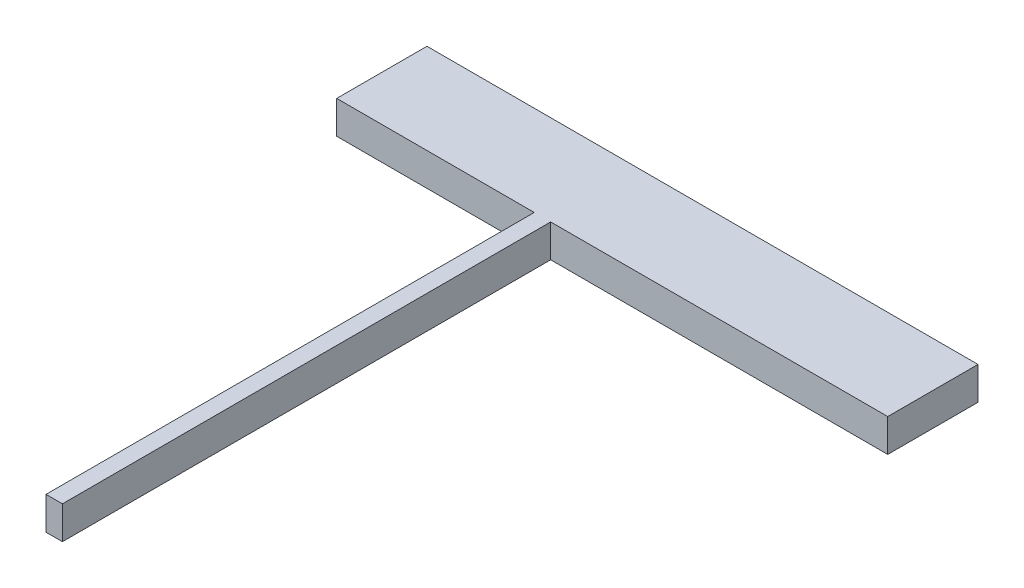
from build123d import *

# Parameters (mm, degrees)
SKETCH_1_W      = 134.3
SKETCH_1_H      = 22
EXTRUDE_1_DEPTH = 8
SKETCH_2_W      = 4
SKETCH_2_H      = 8
EXTRUDE_2_DEPTH = 130


with BuildPart() as part:
    # 草图1 → 凸台-拉伸1 (new body)
    with BuildSketch(Plane(origin=(0, 0, 0), x_dir=(1, 0, 0), z_dir=(0, 1, 0))):
        Rectangle(SKETCH_1_W, SKETCH_1_H)
    extrude(amount=EXTRUDE_1_DEPTH)

    # 草图2 → 凸台-拉伸2 (add)
    with BuildSketch(Plane.XY):
        with Locations((-17, 4)):
            Rectangle(SKETCH_2_W, SKETCH_2_H)
    extrude(amount=EXTRUDE_2_DEPTH)


solid = part.part
